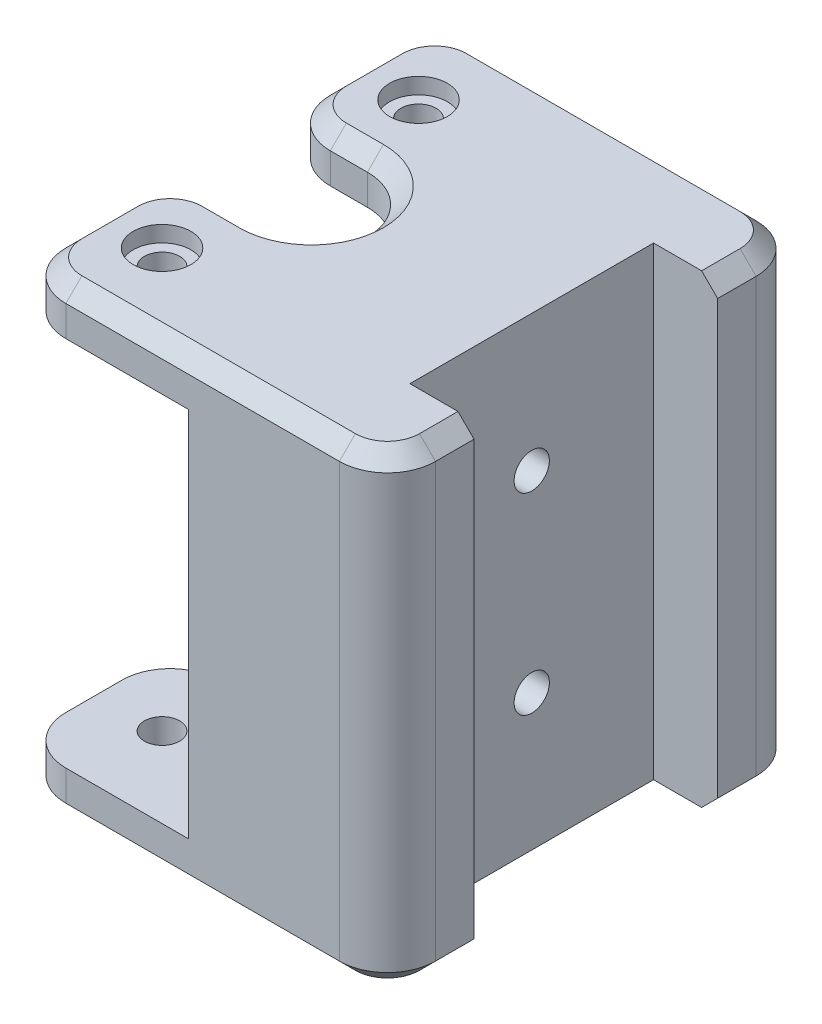
from build123d import *

# Parameters (mm, degrees)
SKETCH_2_W          = 23.064561435
SKETCH_2_H          = 26
SKETCH_2_R          = 1.1
EXTRUDE_1_DEPTH     = 14.5
SKETCH_3_R          = 33
CUT_EXTRUDE_1_DEPTH = 11.6
SKETCH_4_R          = 3.5
CUT_EXTRUDE_2_DEPTH = 54.268776032
SKETCH_5_W          = 15.2
SKETCH_5_H          = 29
CUT_EXTRUDE_3_DEPTH = 4
FILLET_1_R          = 3
SKETCH_6_R          = 1.1
CUT_EXTRUDE_4_DEPTH = 28.252660471
CHAMFER_1_SIZE      = 1
SKETCH_7_R          = 1.8
CUT_EXTRUDE_5_DEPTH = 1
CUT_EXTRUDE_6_DEPTH = 35.75


with BuildPart() as part:
    # Эскиз2 → Бобышка-Вытянуть1 (new, symmetric)
    with BuildSketch(Plane(origin=(0, 0, 0), x_dir=(1, 0, 0), z_dir=(0, 1, 0))):
        with Locations((31.217719282, 0)):
            Rectangle(SKETCH_2_W, SKETCH_2_H)
        with Locations(Location((23.685438565, 8, 0), (0, 0, 90))):
            Circle(SKETCH_2_R, mode=Mode.SUBTRACT)
        with Locations(Location((23.685438565, -8, 0), (0, 0, 90))):
            Circle(SKETCH_2_R, mode=Mode.SUBTRACT)
    extrude(amount=EXTRUDE_1_DEPTH, both=True)

    # Эскиз3 → Вырез-Вытянуть1 (cut, symmetric)
    with BuildSketch(Plane(origin=(0, 0, 0), x_dir=(1, 0, 0), z_dir=(0, 1, 0))):
        Circle(SKETCH_3_R)
    extrude(amount=CUT_EXTRUDE_1_DEPTH, both=True, mode=Mode.SUBTRACT)

    # Эскиз4 → Вырез-Вытянуть2 (cut, through all)
    with BuildSketch(Plane(origin=(0, 14.5, 0), x_dir=(1, 0, 0), z_dir=(0, 1, 0))):
        with Locations((25, 0)):
            Circle(SKETCH_4_R)
        with BuildLine():
            ThreePointArc((25, -3.5), (21.5, 0), (25, 3.5))
            Line((25, 3.5), (19.685438565, 3.5))
            Line((19.685438565, 3.5), (19.685438565, -3.5))
            Line((19.685438565, -3.5), (25, -3.5))
        make_face()
    extrude(amount=-CUT_EXTRUDE_2_DEPTH, mode=Mode.SUBTRACT)

    # Эскиз5 → Вырез-Вытянуть3 (cut)
    with BuildSketch(Plane(origin=(42.75, 0, 0), x_dir=(0, 0, -1), z_dir=(1, 0, 0))):
        Rectangle(SKETCH_5_W, SKETCH_5_H)
    extrude(amount=-CUT_EXTRUDE_3_DEPTH, mode=Mode.SUBTRACT)

    # Скругление1
    fillet_1_edges = [part.edges().sort_by_distance(p)[0] for p in [
        (19.685438565, -13.05, 13),
        (19.685438565, -13.05, -13),
        (19.685438565, 13.05, 3.5),
        (19.685438565, 13.05, -3.5),
        (19.685438565, -13.05, 3.5),
        (19.685438565, -13.05, -3.5),
        (42.75, 0, 13),
        (19.685438565, 13.05, 13),
        (19.685438565, 13.05, -13),
        (42.75, 0, -13),
    ]]
    fillet(fillet_1_edges, radius=FILLET_1_R)

    # Эскиз6 → Вырез-Вытянуть4 (cut, through all)
    with BuildSketch(Plane(origin=(38.75, 0, 0), x_dir=(0, 0, -1), z_dir=(1, 0, 0))):
        with Locations((0, 6)):
            Circle(SKETCH_6_R)
        with Locations((0, -6)):
            Circle(SKETCH_6_R)
    extrude(amount=-CUT_EXTRUDE_4_DEPTH, mode=Mode.SUBTRACT)

    # Фаска1
    chamfer_1_edges = [part.edges().sort_by_distance(p)[0] for p in [
        (20.564118221, 14.5, 12.121320344),
        (20.564118221, 14.5, 4.378679656),
        (20.564118221, 14.5, -4.378679656),
        (20.564118221, 14.5, -12.121320344),
        (41.871320344, 14.5, -12.121320344),
        (28.5, -14.5, 0),
        (23.842719282, -14.5, -3.5),
        (28.5, 14.5, 0),
        (23.842719282, 14.5, -3.5),
        (42.75, -14.5, -8.8),
        (42.75, 14.5, -8.8),
        (31.217719282, 14.5, -13),
        (31.217719282, -14.5, -13),
        (42.75, -14.5, 8.8),
        (31.217719282, -14.5, 13),
        (19.685438565, -14.5, 8.25),
        (23.842719282, -14.5, 3.5),
        (19.685438565, -14.5, -8.25),
        (41.871320344, -14.5, 12.121320344),
        (20.564118221, -14.5, 12.121320344),
        (20.564118221, -14.5, 4.378679656),
        (20.564118221, -14.5, -4.378679656),
        (20.564118221, -14.5, -12.121320344),
        (41.871320344, -14.5, -12.121320344),
        (19.685438565, 14.5, -8.25),
        (23.842719282, 14.5, 3.5),
        (19.685438565, 14.5, 8.25),
        (31.217719282, 14.5, 13),
        (42.75, 14.5, 8.8),
        (41.871320344, 14.5, 12.121320344),
    ]]
    chamfer(chamfer_1_edges, length=CHAMFER_1_SIZE)

    # Эскиз7 → Вырез-Вытянуть5 (cut)
    with BuildSketch(Plane(origin=(0, 14.5, 0), x_dir=(1, 0, 0), z_dir=(0, 1, 0))):
        with Locations(Location((23.685438565, 8, 0), (0, 0, 270))):
            Circle(SKETCH_7_R)
        with Locations(Location((23.685438565, -8, 0), (0, 0, 270))):
            Circle(SKETCH_7_R)
    cut_extrude_5 = extrude(amount=-CUT_EXTRUDE_5_DEPTH, mode=Mode.SUBTRACT)

    # Зеркальное отражение1: Вырез-Вытянуть5 across plane
    add(cut_extrude_5.mirror(Plane.ZX), mode=Mode.SUBTRACT)

    # Эскиз8 → Вырез-Вытянуть6 (cut)
    with BuildSketch(Plane(origin=(0, 0, 0), x_dir=(0, 0, -1), z_dir=(1, 0, 0))):
        Polygon((1.125833025, 4.05), (2.25166605, 6), (1.125833025, 7.95), (-1.125833025, 7.95), (-2.25166605, 6), (-1.125833025, 4.05), align=None)
        Polygon((1.125833025, -7.95), (2.25166605, -6), (1.125833025, -4.05), (-1.125833025, -4.05), (-2.25166605, -6), (-1.125833025, -7.95), align=None)
    extrude(amount=CUT_EXTRUDE_6_DEPTH, mode=Mode.SUBTRACT)


solid = part.part
